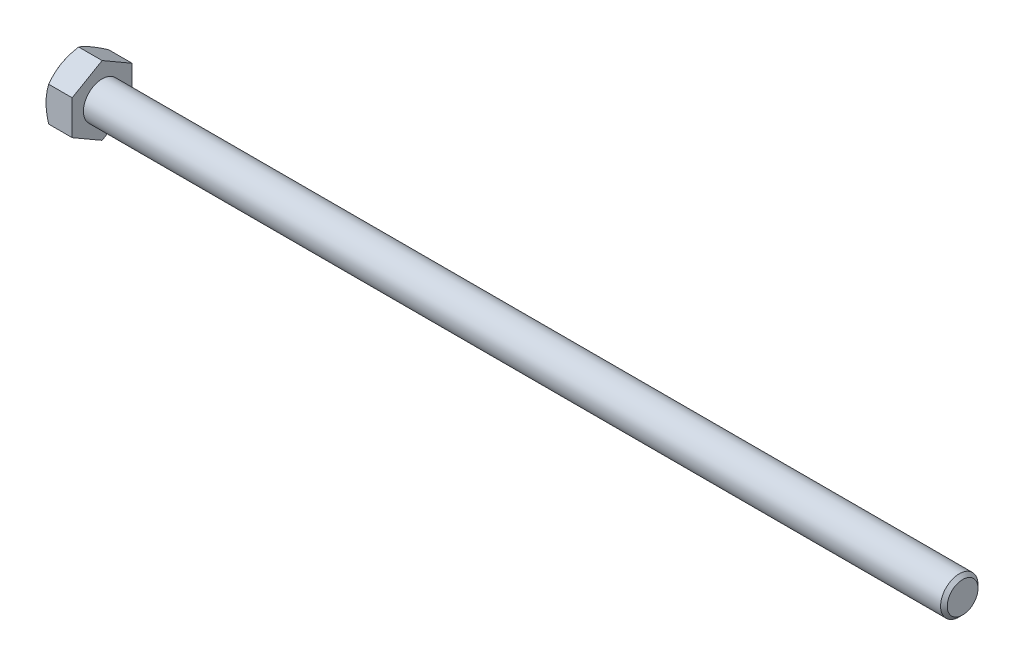
from build123d import *

# Parameters (mm, degrees)
BASEHEAD_DEPTH = 3.5


with BuildPart() as part:
    # Sketch1 → BaseHead (new body)
    with BuildSketch(Plane(origin=(0, 0, 0), x_dir=(0, 0, -1), z_dir=(1, 0, 0))):
        Polygon((4, 2.309401077), (4, -2.309401077), (0, -4.618802154), (-4, -2.309401077), (-4, 2.309401077), (0, 4.618802154), align=None)
    extrude(amount=BASEHEAD_DEPTH)

    # BodySke → BaseBody (revolve)
    with BuildSketch(Plane.XY, mode=Mode.PRIVATE) as basebody_sk:
        Polygon((0, 0), (118.5, 0), (118.5, 2.055), (118.055, 2.5), (0, 2.5), align=None)
    revolve(basebody_sk.sketch.rotate(Axis((0, 0, 0), (1, 0, 0)), 90), axis=Axis((0, 0, 0), (1, 0, 0)))

    # Sketch3 → HeadChamfer (revolve, cut)
    with BuildSketch(Plane.XY):
        Polygon((0, 4), (3.244016936, 9.618802154), (3.244016936, 14.618802154), (-10, 14.618802154), (-10, 4), align=None)
    revolve(axis=Axis((0, 0, 0), (1, 0, 0)), mode=Mode.SUBTRACT)


solid = part.part
